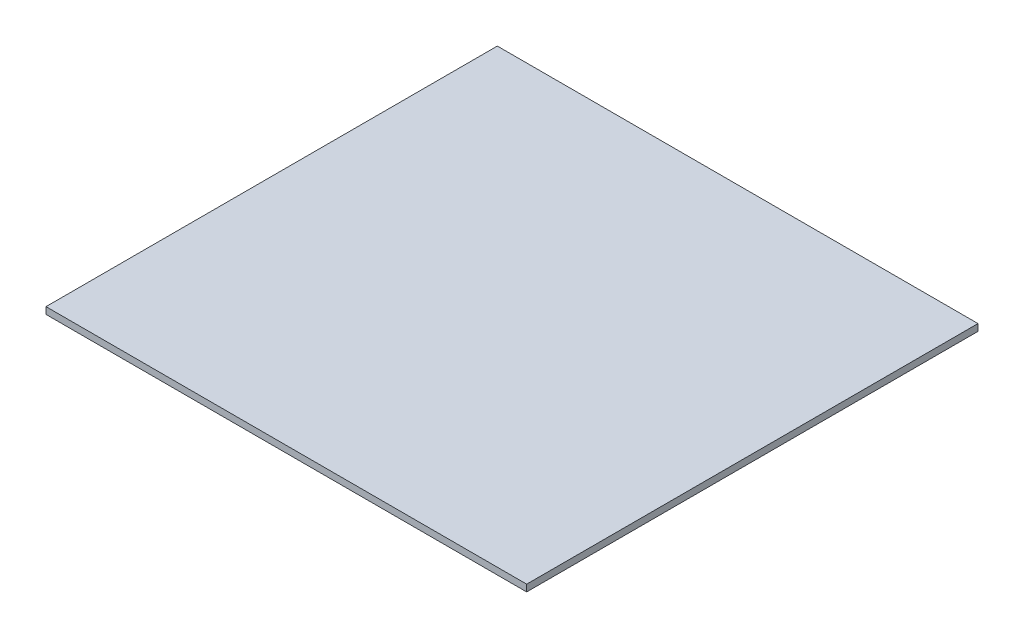
from build123d import *

# Parameters (mm, degrees)
SKETCH1_W           = 213
SKETCH1_H           = 200
BOSS_EXTRUDE1_DEPTH = 3


with BuildPart() as part:
    # Sketch1 → Boss-Extrude1 (new body)
    with BuildSketch(Plane(origin=(0, 0, 0), x_dir=(1, 0, 0), z_dir=(0, 1, 0))):
        with Locations((106.5, 100)):
            Rectangle(SKETCH1_W, SKETCH1_H)
    extrude(amount=BOSS_EXTRUDE1_DEPTH)


solid = part.part
